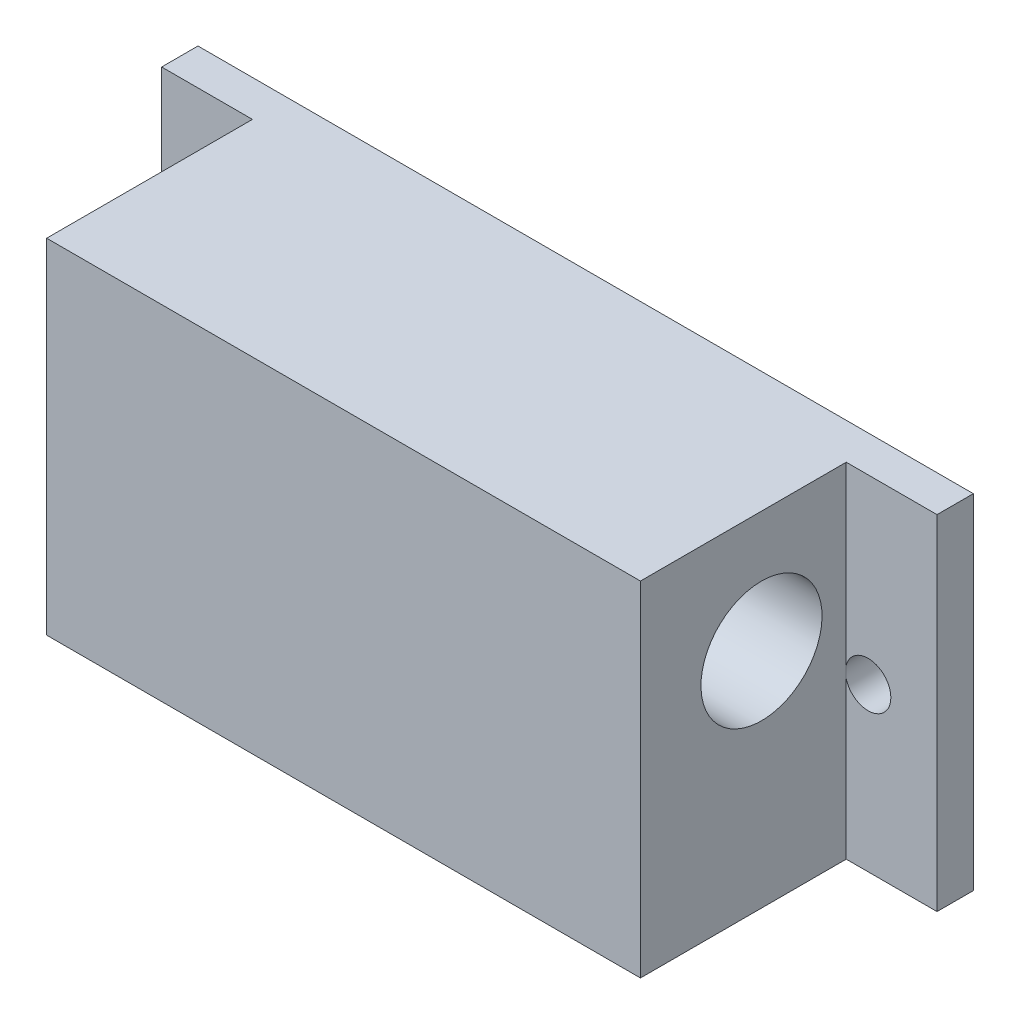
from build123d import *

# Parameters (mm, degrees)
SKETCH3_W                      = 31.148374891
SKETCH3_H                      = 19.837641971
BOSS_EXTRUDE1_DEPTH            = 6.35
SKETCH4_R                      = 3.175
CUT_EXTRUDE1_DEPTH             = 9.525
SKETCH5_R                      = 3.175
CUT_EXTRUDE5_DEPTH             = 9.525
CUT_EXTRUDE5_DIRECTION_2_REACH = 33.299
SKETCH6_R                      = 3.175
CUT_EXTRUDE6_DEPTH             = 9.525
SKETCH8_W                      = 12.7
SKETCH8_H                      = 1.803641971
CUT_EXTRUDE7_DEPTH             = 38.470999417
SKETCH9_W                      = 1.905
SKETCH9_H                      = 18.034
BOSS_EXTRUDE2_DEPTH            = 4.7625
SKETCH11_W                     = 1.190625
SKETCH11_H                     = 1.906


with BuildPart() as part:
    # Sketch3 → Boss-Extrude1 (new, symmetric)
    with BuildSketch(Plane.XY):
        with Locations((15.574187446, -9.918820986)):
            Rectangle(SKETCH3_W, SKETCH3_H)
    extrude(amount=BOSS_EXTRUDE1_DEPTH, both=True)

    # Sketch4 → Cut-Extrude1 (cut)
    with BuildSketch(Plane.ZY):
        with Locations(Location((0, -6.35, 0), (0, 0, 270))):
            Circle(SKETCH4_R)
    cut_extrude1 = extrude(amount=-CUT_EXTRUDE1_DEPTH, mode=Mode.SUBTRACT)

    # Sketch5 → Cut-Extrude5 (cut)
    with BuildSketch(Plane(origin=(7.787093723, -19.837641971, 0), x_dir=(-0.8660254037844382, 0.500000000000001, 0), z_dir=(-0.500000000000001, -0.8660254037844382, 0))):
        with Locations(Location((0, 0, 0), (0, 0, 180))):
            Circle(SKETCH5_R)
    cut_extrude5 = extrude(amount=-CUT_EXTRUDE5_DEPTH, mode=Mode.SUBTRACT)

    # Sketch5 → Cut-Extrude5 direction 2 (cut, up to next)
    with BuildSketch(Plane(origin=(7.787093723, -19.837641971, 0), x_dir=(-0.8660254037844382, 0.500000000000001, 0), z_dir=(-0.500000000000001, -0.8660254037844382, 0)), mode=Mode.PRIVATE) as cut_extrude5_direction_2_sk1:
        with Locations(Location((0, 0, 0), (0, 0, 180))):
            Circle(SKETCH5_R)
    cut_extrude5_direction_2_tool1 = extrude(cut_extrude5_direction_2_sk1.sketch, amount=CUT_EXTRUDE5_DIRECTION_2_REACH, mode=Mode.PRIVATE) & part.part
    cut_extrude5_direction_2 = cut_extrude5_direction_2_tool1.solids().sort_by_distance((7.787094, -19.837642, 0))[0]
    add(cut_extrude5_direction_2, mode=Mode.SUBTRACT)

    # Sketch6 → Cut-Extrude6 (cut)
    with BuildSketch(Plane(origin=(0, 0, -6.35), x_dir=(-1, 0, 0), z_dir=(0, 0, -1))):
        with Locations((-15.574187445, -6.35)):
            Circle(SKETCH6_R)
    extrude(amount=-CUT_EXTRUDE6_DEPTH, mode=Mode.SUBTRACT)

    # Mirror1: Cut-Extrude1, Cut-Extrude5, Cut-Extrude5 direction 2 across plane
    add(cut_extrude1.mirror(Plane.ZY.offset(-15.574187445)), mode=Mode.SUBTRACT)
    add(cut_extrude5.mirror(Plane.ZY.offset(-15.574187445)), mode=Mode.SUBTRACT)
    add(cut_extrude5_direction_2.mirror(Plane.ZY.offset(-15.574187445)), mode=Mode.SUBTRACT)

    # Sketch8 → Cut-Extrude7 (cut, through all)
    with BuildSketch(Plane(origin=(31.148374891, 0, 0), x_dir=(0, 0, -1), z_dir=(1, 0, 0))):
        with Locations((0, -18.935820986)):
            Rectangle(SKETCH8_W, SKETCH8_H)
    extrude(amount=-CUT_EXTRUDE7_DEPTH, mode=Mode.SUBTRACT)

    # Sketch9 → Boss-Extrude2 (add)
    with BuildSketch(Plane(origin=(31.148374891, 0, 0), x_dir=(0, 0, -1), z_dir=(1, 0, 0))):
        with Locations((5.3975, -9.017)):
            Rectangle(SKETCH9_W, SKETCH9_H)
    boss_extrude2 = extrude(amount=BOSS_EXTRUDE2_DEPTH)

    # Sketch11 → 3/32 (0.09375) Diameter Hole1 (revolve, cut)
    with BuildSketch(Plane(origin=(32.297076923, -9.525, -4.445), x_dir=(0, -1, 0), z_dir=(1, 0, 0))):
        with Locations((0.5953125, 0.953)):
            Rectangle(SKETCH11_W, SKETCH11_H)
    f_3_32_0_09375_diameter_hole1 = revolve(axis=Axis((32.297076923, -9.525, 1.905), (0, 0, -1)), mode=Mode.SUBTRACT)

    # Mirror2: Boss-Extrude2, 3/32 (0.09375) Diameter Hole1 across plane
    add(boss_extrude2.mirror(Plane.ZY.offset(-15.574187445)))
    add(f_3_32_0_09375_diameter_hole1.mirror(Plane.ZY.offset(-15.574187445)), mode=Mode.SUBTRACT)


solid = part.part
